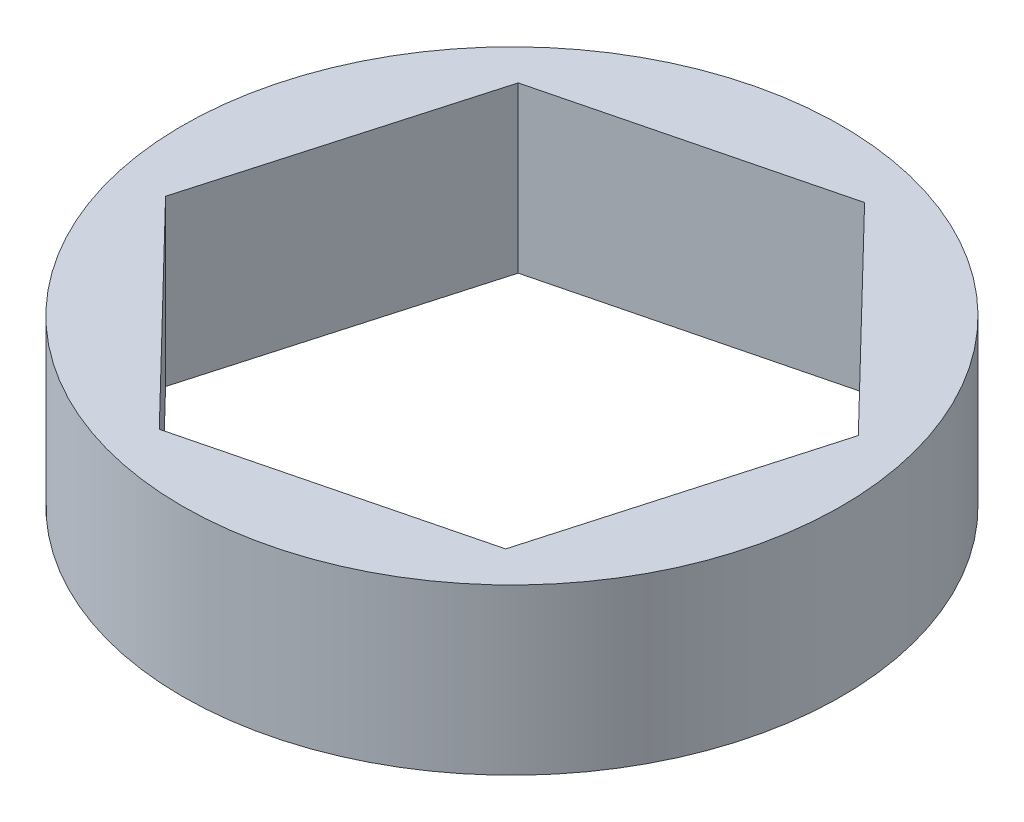
from build123d import *

# Parameters (mm, degrees)
SKETCH1_R           = 6.35
BOSS_EXTRUDE1_DEPTH = 3.175


with BuildPart() as part:
    # Sketch1 → Boss-Extrude1 (new body)
    with BuildSketch(Plane(origin=(0, 0, 0), x_dir=(1, 0, 0), z_dir=(0, 1, 0))):
        with Locations(Location((0, 0, 0), (0, 0, 270))):
            Circle(SKETCH1_R)
        Polygon((1.505663563, 5.289125848), (-3.827685567, 3.948505819), (-5.333349129, -1.340620029), (-1.505663563, -5.289125848), (3.827685567, -3.948505819), (5.333349129, 1.340620029), align=None, mode=Mode.SUBTRACT)
    extrude(amount=BOSS_EXTRUDE1_DEPTH)


solid = part.part
